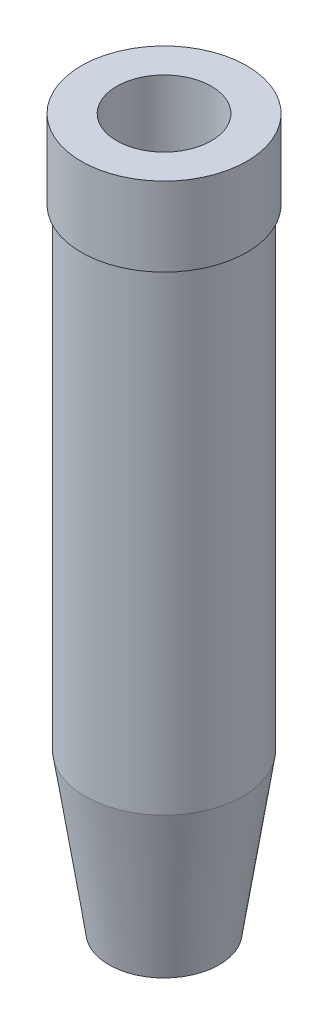
from build123d import *


with BuildPart() as part:
    # Sketch1 → Revolve1 (revolve)
    with BuildSketch(Plane.XY, mode=Mode.PRIVATE) as revolve1_sk:
        Polygon((3, 0), (3, 45), (5.25, 45), (5.25, 40), (5, 40), (5, 10), (3.5, 0), align=None)
    revolve(revolve1_sk.sketch.rotate(Axis((0, 0, 0), (0, 1, 0)), 90), axis=Axis((0, 0, 0), (0, 1, 0)))


solid = part.part
